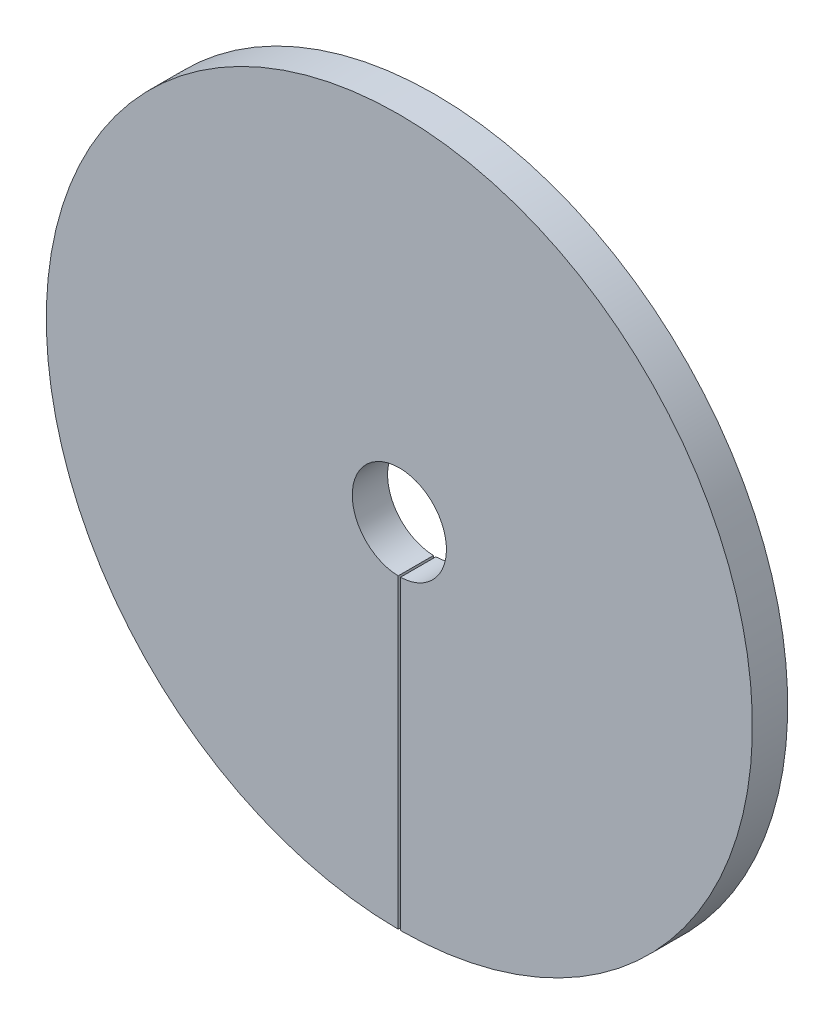
from build123d import *

# Parameters (mm, degrees)
RESSALTO_EXTRUS_O1_DEPTH = 3


with BuildPart() as part:
    # Esboço1 → Ressalto-extrusão1 (new body)
    with BuildSketch(Plane.XY):
        with BuildLine():
            Line((0.1, -3.998749805), (0.1, -29.999833333))
            ThreePointArc((0.1, -29.999833333), (0, 30), (-0.1, -29.999833333))
            Line((-0.1, -29.999833333), (-0.1, -3.998749805))
            ThreePointArc((-0.1, -3.998749805), (0, 4), (0.1, -3.998749805))
        make_face()
    extrude(amount=RESSALTO_EXTRUS_O1_DEPTH)


solid = part.part
